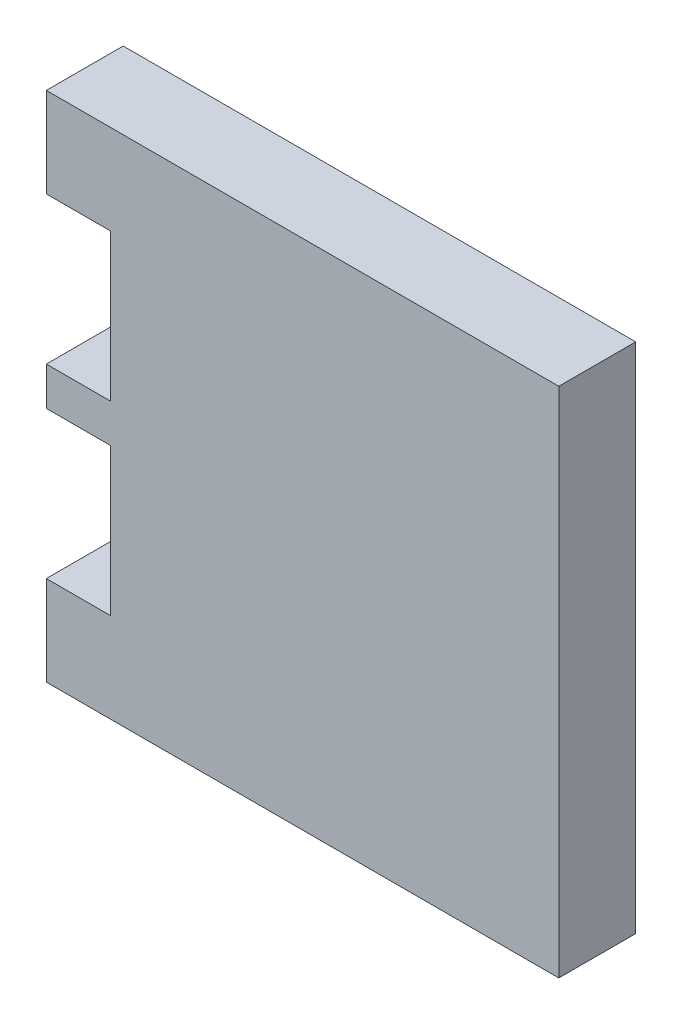
from build123d import *

# Parameters (mm, degrees)
SKETCH1_W           = 45
SKETCH1_H           = 40
BOSS_EXTRUDE1_DEPTH = 6
SKETCH2_W           = 5
SKETCH2_H           = 11.5
CUT_EXTRUDE1_DEPTH  = 6
SKETCH3_W           = 5
SKETCH3_H           = 9
SKETCH3_H_2         = 3
CUT_EXTRUDE3_DEPTH  = 6
SKETCH4_W           = 8.469823435
SKETCH4_H           = 40.874478331
CUT_EXTRUDE4_DEPTH  = 6


with BuildPart() as part:
    # Sketch1 → Boss-Extrude1 (new body)
    with BuildSketch(Plane.XY):
        with Locations((-3.25562701, 9.807073955)):
            Rectangle(SKETCH1_W, SKETCH1_H)
    extrude(amount=BOSS_EXTRUDE1_DEPTH)

    # Sketch2 → Cut-Extrude1 (cut)
    with BuildSketch(Plane.XY.offset(6)):
        with Locations((-23.25562701, 17.057073955)):
            Rectangle(SKETCH2_W, SKETCH2_H)
        with Locations((-23.25562701, 2.557073955)):
            Rectangle(SKETCH2_W, SKETCH2_H)
    extrude(amount=-CUT_EXTRUDE1_DEPTH, mode=Mode.SUBTRACT)

    # Sketch3 → Cut-Extrude3 (cut)
    with BuildSketch(Plane.XY.offset(6)):
        with Locations((16.74437299, 25.307073955)):
            Rectangle(SKETCH3_W, SKETCH3_H)
        with Locations((16.74437299, 9.807073955)):
            Rectangle(SKETCH3_W, SKETCH3_H_2)
        with Locations((16.74437299, -5.692926045)):
            Rectangle(SKETCH3_W, SKETCH3_H)
    extrude(amount=-CUT_EXTRUDE3_DEPTH, mode=Mode.SUBTRACT)

    # Sketch4 → Cut-Extrude4 (cut)
    with BuildSketch(Plane.XY.offset(6)):
        with Locations((18.479284707, 9.36983479)):
            Rectangle(SKETCH4_W, SKETCH4_H)
    extrude(amount=-CUT_EXTRUDE4_DEPTH, mode=Mode.SUBTRACT)


solid = part.part
